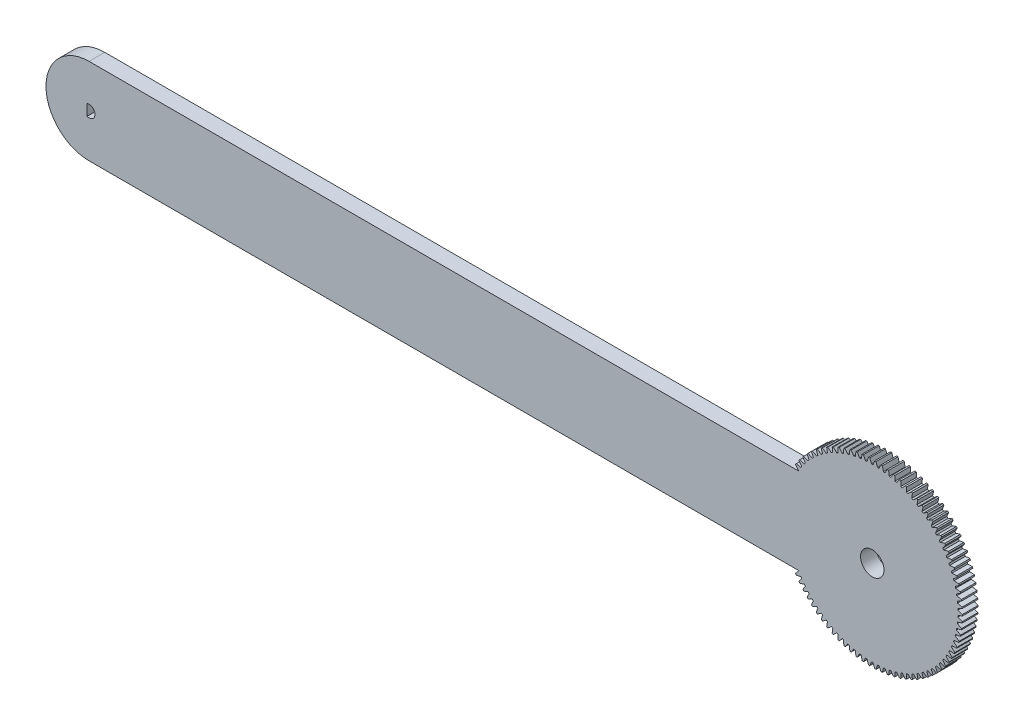
from build123d import *

# Parameters (mm, degrees)
BASPROSKE_W           = 4
BASPROSKE_H           = 23
TOOTHCUT_DEPTH        = 33.771939216
TEETHCUTS_COUNT       = 90
TEETHCUTS_ANGLE       = 356
BORSKE_R              = 5
BORE_DEPTH            = 50.0000508
BOSS_EXTRUDE1_DEPTH   = 4
CUT_EXTRUDE2_DEPTH    = 213.286586066
SKETCH4_R             = 3
CUT_EXTRUDE4_DEPTH    = 213.286586066
BODY_MOVE_COPY1_ANGLE = 90
BODY_MOVE_COPY2_ANGLE = 180


with BuildPart() as part:
    # BasProSke → Base-Revolve (revolve)
    with BuildSketch(Plane(origin=(0, 0, 0), x_dir=(1, 0, 0), z_dir=(0, 1, 0)), mode=Mode.PRIVATE) as base_revolve_sk:
        with Locations((2, 11.5)):
            Rectangle(BASPROSKE_W, BASPROSKE_H)
    revolve(base_revolve_sk.sketch.rotate(Axis((-10, 0, 0), (1, 0, 0)), 180), axis=Axis((-10, 0, 0), (1, 0, 0)))

    # TooCutSke → ToothCut (cut, through all)
    with BuildSketch(Plane(origin=(0, 0, 0), x_dir=(0, 0, -1), z_dir=(1, 0, 0))):
        with BuildLine():
            ThreePointArc((0.208497677, 21.873006303), (0, 21.874), (-0.208497677, 21.873006303))
            ThreePointArc((-0.208497677, 21.873006303), (-0.408932112, 22.452130021), (-0.648312723, 23.016271109))
            ThreePointArc((-0.648312723, 23.016271109), (0, 23.0254), (0.648312723, 23.016271109))
            ThreePointArc((0.648312723, 23.016271109), (0.408932112, 22.452130021), (0.208497677, 21.873006303))
        make_face()
    toothcut = extrude(amount=TOOTHCUT_DEPTH, mode=Mode.SUBTRACT)

    # TeethCuts: ToothCut ×90 about axis
    teethcuts_axis = Axis((-10, 0, 0), (1, 0, 0))
    for i in range(1, TEETHCUTS_COUNT):
        add(toothcut.rotate(teethcuts_axis, i * TEETHCUTS_ANGLE / (TEETHCUTS_COUNT - 1)), mode=Mode.SUBTRACT)

    # BorSke → Bore (cut, symmetric)
    with BuildSketch(Plane(origin=(0, 0, 0), x_dir=(0, 0, -1), z_dir=(1, 0, 0))):
        with Locations(Location((0, 0, 0), (0, 0, 180))):
            Circle(BORSKE_R)
    extrude(amount=BORE_DEPTH, both=True, mode=Mode.SUBTRACT)

    # Sketch1 → Boss-Extrude1 (add)
    with BuildSketch(Plane(origin=(0, 0, 0), x_dir=(0, 0, -1), z_dir=(1, 0, 0))):
        with BuildLine():
            Line((0, -11), (-200, -11))
            ThreePointArc((-200, -11), (-211, 0), (-200, 11))
            Line((-200, 11), (0, 11))
            ThreePointArc((0, 11), (11, 0), (0, -11))
        make_face()
    extrude(amount=BOSS_EXTRUDE1_DEPTH)

    # Sketch3 → Cut-Extrude2 (cut, through all)
    with BuildSketch(Plane(origin=(0, 0, 0), x_dir=(0, 0, -1), z_dir=(1, 0, 0))):
        with BuildLine():
            ThreePointArc((-198.5, 0), (-199.133974596, 1.224744871), (-200.5, 1.414213562))
            Line((-200.5, 1.414213562), (-200.5, -1.414213562))
            ThreePointArc((-200.5, -1.414213562), (-199.133974596, -1.224744871), (-198.5, 0))
        make_face()
    extrude(amount=CUT_EXTRUDE2_DEPTH, mode=Mode.SUBTRACT)

    # Sketch4 → Cut-Extrude4 (cut, through all)
    with BuildSketch(Plane(origin=(0, 0, 0), x_dir=(0, 0, -1), z_dir=(1, 0, 0))):
        Circle(SKETCH4_R)
    extrude(amount=CUT_EXTRUDE4_DEPTH, mode=Mode.SUBTRACT)


with BuildPart() as part_1:
    # Body-Move/Copy1: moved
    add(part.part.rotate(Axis((2, 0, 94), (0, 1, 0)), BODY_MOVE_COPY1_ANGLE))


with BuildPart() as part_2:
    # Body-Move/Copy2: moved
    add(part_1.part.rotate(Axis((2, 0, 0), (0, 0, 1)), BODY_MOVE_COPY2_ANGLE))


solid = part_2.part
